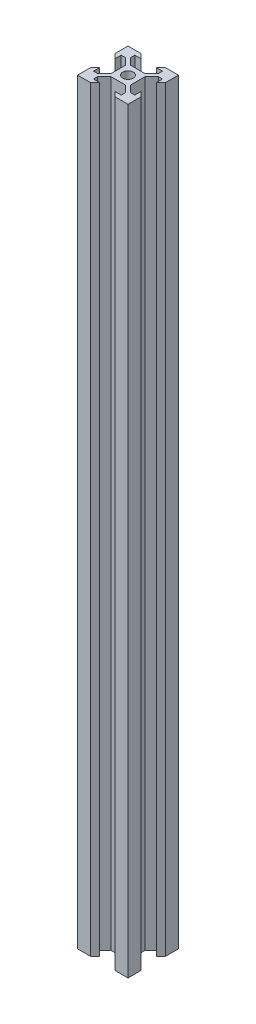
from build123d import *

# Parameters (mm, degrees)
SKETCH1_R           = 2.1
BOSS_EXTRUDE1_DEPTH = 300


with BuildPart() as part:
    # Sketch1 → Boss-Extrude1 (new body)
    with BuildSketch(Plane(origin=(0, 0, 0), x_dir=(1, 0, 0), z_dir=(0, 1, 0))):
        Polygon((-3.900660172, -2.84), (-3.900660172, 0), (-3.900660172, 2.84), (-6.56, 5.499339828), (-8.2, 5.499339828), (-8.2, 3.1), (-10, 4.9), (-10, 10), (-4.9, 10), (-3.1, 8.2), (-5.499339828, 8.2), (-5.499339828, 6.56), (-2.84, 3.900660172), (0, 3.900660172), (2.84, 3.900660172), (5.499339828, 6.56), (5.499339828, 8.2), (3.1, 8.2), (4.9, 10), (10, 10), (10, 4.9), (8.2, 3.1), (8.2, 5.499339828), (6.56, 5.499339828), (3.900660172, 2.84), (3.900660172, 0), (3.900660172, -2.84), (6.56, -5.499339828), (8.2, -5.499339828), (8.2, -3.1), (10, -4.9), (10, -10), (4.9, -10), (3.1, -8.2), (5.499339828, -8.2), (5.499339828, -6.56), (2.84, -3.900660172), (0, -3.900660172), (-2.84, -3.900660172), (-5.499339828, -6.56), (-5.499339828, -8.2), (-3.1, -8.2), (-4.9, -10), (-10, -10), (-10, -4.9), (-8.2, -3.1), (-8.2, -5.499339828), (-6.56, -5.499339828), align=None)
        with Locations(Location((0, 0, 0), (0, 0, 270))):
            Circle(SKETCH1_R, mode=Mode.SUBTRACT)
    extrude(amount=BOSS_EXTRUDE1_DEPTH)


solid = part.part
